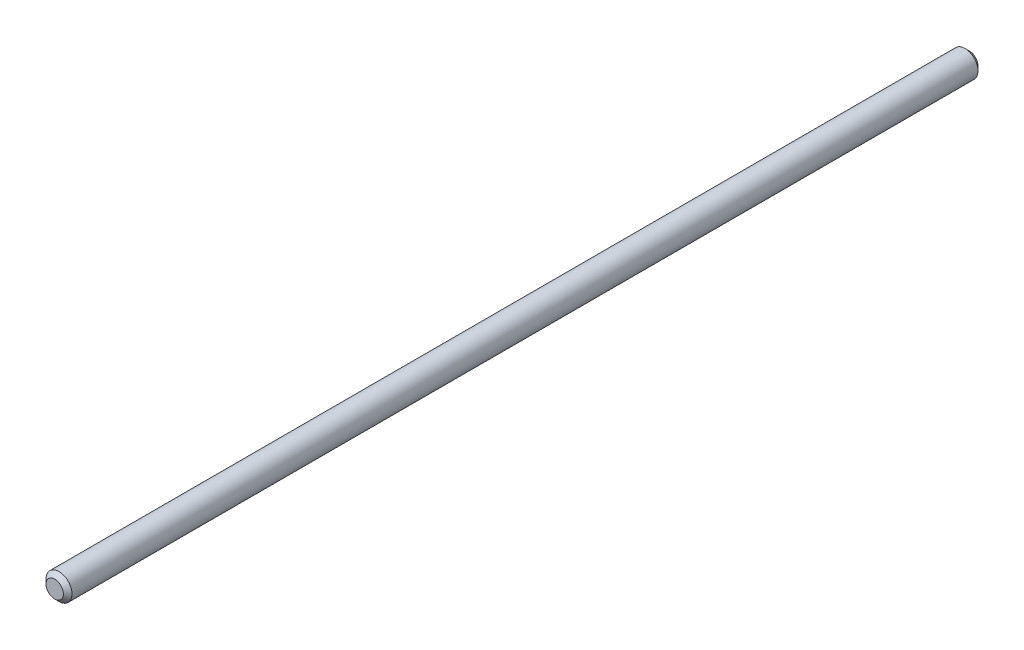
from build123d import *

# Parameters (mm, degrees)
ESQUISSE1_R          = 1.5
BASE_EXTRUSION_DEPTH = 52.75559792
CHANFREIN1_SIZE      = 0.5


with BuildPart() as part:
    # Esquisse1 → Base-Extrusion (new, symmetric)
    with BuildSketch(Plane.XY):
        Circle(ESQUISSE1_R)
    extrude(amount=BASE_EXTRUSION_DEPTH, both=True)

    # Chanfrein1
    chanfrein1_edges = [part.edges().sort_by_distance(p)[0] for p in [
        (-1.5, 0, -52.75559792),
        (-1.5, 0, 52.75559792),
    ]]
    chamfer(chanfrein1_edges, length=CHANFREIN1_SIZE)


solid = part.part
